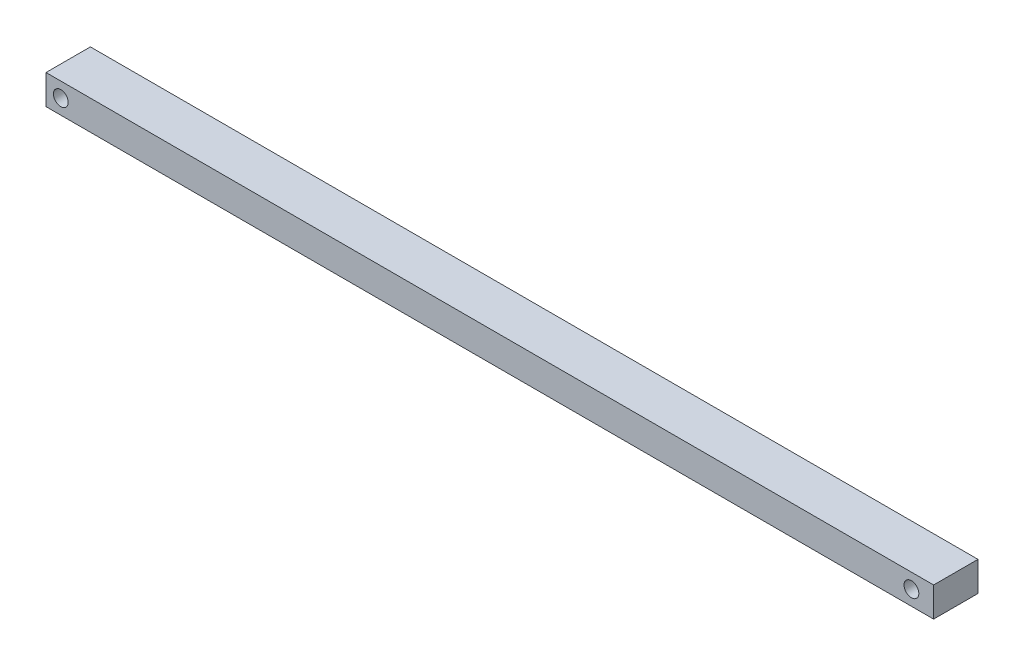
from build123d import *

# Parameters (mm, degrees)
SKETCH1_W           = 600
SKETCH1_H           = 20
SKETCH1_R           = 5
BOSS_EXTRUDE1_DEPTH = 30


with BuildPart() as part:
    # Sketch1 → Boss-Extrude1 (new body)
    with BuildSketch(Plane.XY):
        with Locations((300, 10)):
            Rectangle(SKETCH1_W, SKETCH1_H)
        with Locations((10, 10)):
            Circle(SKETCH1_R, mode=Mode.SUBTRACT)
        with Locations((585, 10)):
            Circle(SKETCH1_R, mode=Mode.SUBTRACT)
    extrude(amount=-BOSS_EXTRUDE1_DEPTH)


solid = part.part
